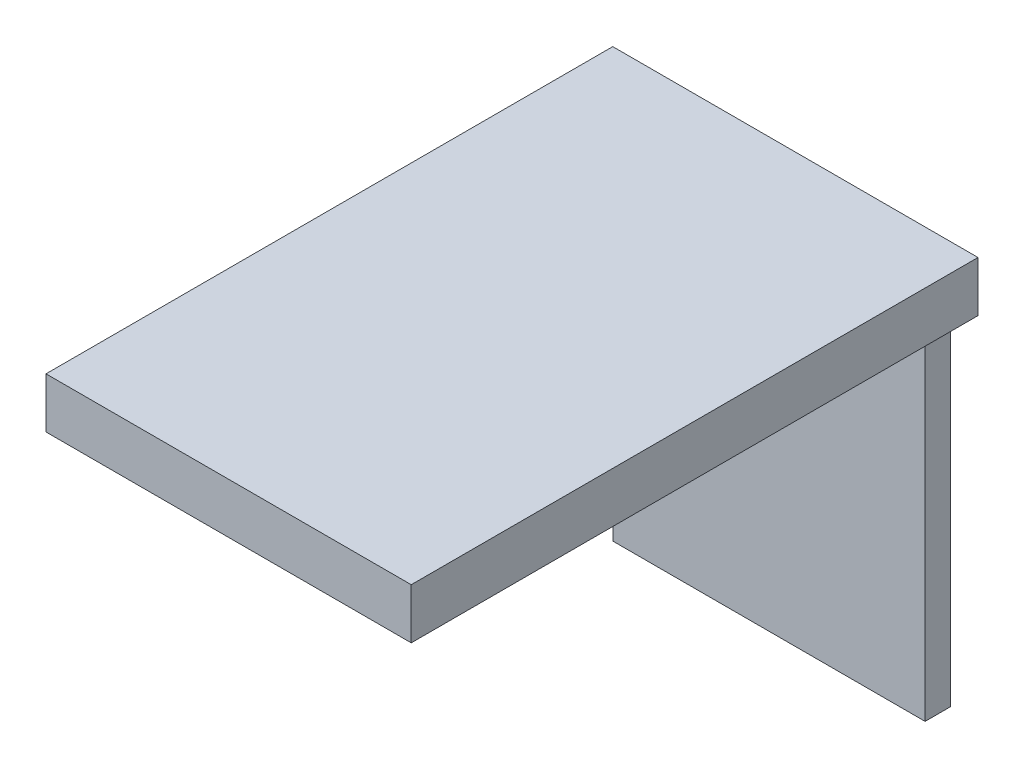
from build123d import *

# Parameters (mm, degrees)
SKETCH1_W           = 29
SKETCH1_H           = 45
SKETCH1_W_2         = 25
SKETCH1_H_2         = 41
BOSS_EXTRUDE1_DEPTH = 3
SKETCH2_W           = 29
SKETCH2_H           = 45
BOSS_EXTRUDE2_DEPTH = 1
SKETCH4_W           = 24.8
SKETCH4_H           = 2
BOSS_EXTRUDE3_DEPTH = 28


with BuildPart() as part:
    # Sketch1 → Boss-Extrude1 (new body)
    with BuildSketch(Plane(origin=(0, 0, 0), x_dir=(1, 0, 0), z_dir=(0, 1, 0))):
        Rectangle(SKETCH1_W, SKETCH1_H)
        Rectangle(SKETCH1_W_2, SKETCH1_H_2, mode=Mode.SUBTRACT)
    extrude(amount=BOSS_EXTRUDE1_DEPTH)

    # Sketch2 → Boss-Extrude2 (add)
    with BuildSketch(Plane(origin=(0, 3, 0), x_dir=(1, 0, 0), z_dir=(0, 1, 0))):
        Rectangle(SKETCH2_W, SKETCH2_H)
    extrude(amount=BOSS_EXTRUDE2_DEPTH)

    # Sketch4 → Boss-Extrude3 (add)
    with BuildSketch(Plane(origin=(0, 0, 0), x_dir=(-1, 0, 0), z_dir=(0, -1, 0))):
        with Locations((0.1, 21.5)):
            Rectangle(SKETCH4_W, SKETCH4_H)
    extrude(amount=BOSS_EXTRUDE3_DEPTH)


solid = part.part
